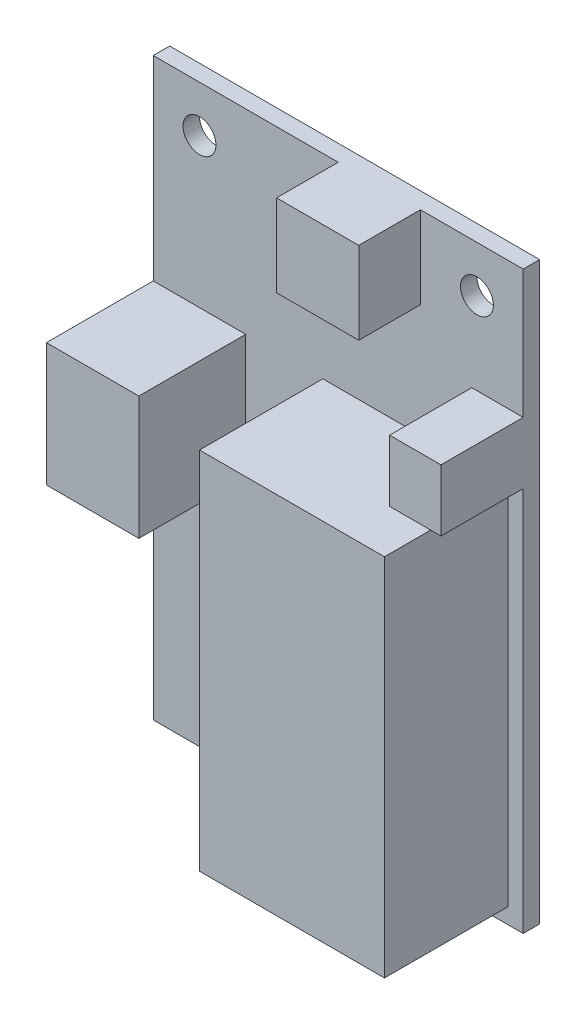
from build123d import *

# Parameters (mm, degrees)
ESQUISSE1_W          = 36
ESQUISSE1_H          = 56
ESQUISSE1_R          = 1.6
BOARD_DEPTH          = 1.6
ESQUISSE2_W          = 8
ESQUISSE2_H          = 8
RS232_DEPTH          = 6
ESQUISSE3_W          = 5
ESQUISSE3_H          = 6
LIMIT_SWITCH_DEPTH   = 8
ESQUISSE4_W          = 18
ESQUISSE4_H          = 35.5
TEENSY_4_0_DEPTH     = 12
ESQUISSE5_W          = 9
ESQUISSE5_H          = 12
F_5V_REGULATOR_DEPTH = 10.4


with BuildPart() as part:
    # Esquisse1 → Board (new body)
    with BuildSketch(Plane.XY):
        with Locations((-18, 28)):
            Rectangle(ESQUISSE1_W, ESQUISSE1_H)
        with Locations((-31.5, 51.5)):
            Circle(ESQUISSE1_R, mode=Mode.SUBTRACT)
        with Locations((-4.5, 51.5)):
            Circle(ESQUISSE1_R, mode=Mode.SUBTRACT)
    extrude(amount=BOARD_DEPTH)

    # Esquisse2 → RS232 (add)
    with BuildSketch(Plane.XY.offset(1.6)):
        with Locations((-14, 52)):
            Rectangle(ESQUISSE2_W, ESQUISSE2_H)
    extrude(amount=RS232_DEPTH)

    # Esquisse3 → Limit switch (add)
    with BuildSketch(Plane.XY.offset(1.6)):
        with Locations((-2.5, 40.5)):
            Rectangle(ESQUISSE3_W, ESQUISSE3_H)
    extrude(amount=LIMIT_SWITCH_DEPTH)

    # Esquisse4 → Teensy 4.0 (add)
    with BuildSketch(Plane.XY.offset(1.6)):
        with Locations((-10.5, 19.25)):
            Rectangle(ESQUISSE4_W, ESQUISSE4_H)
    extrude(amount=TEENSY_4_0_DEPTH)

    # Esquisse5 → 5v regulator (add)
    with BuildSketch(Plane.XY.offset(1.6)):
        with Locations((-31.5, 31)):
            Rectangle(ESQUISSE5_W, ESQUISSE5_H)
    extrude(amount=F_5V_REGULATOR_DEPTH)


solid = part.part
